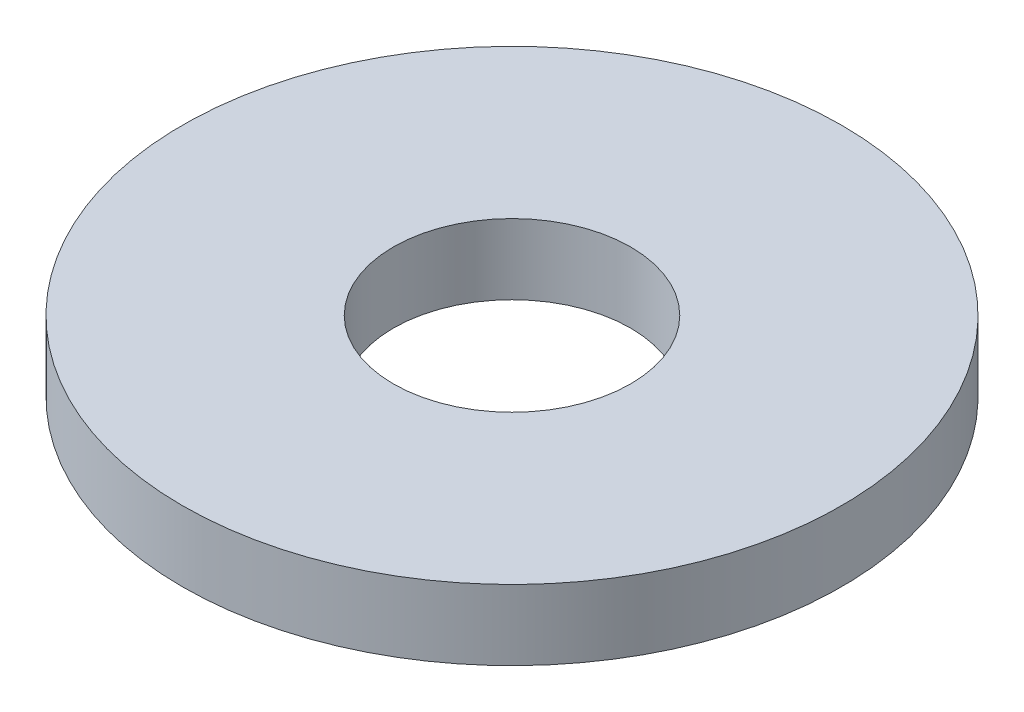
from build123d import *

# Parameters (mm, degrees)
SKETCH1_W = 2.4
SKETCH1_H = 0.8


with BuildPart() as part:
    # Sketch1 → Revolve1 (revolve)
    with BuildSketch(Plane.XY, mode=Mode.PRIVATE) as revolve1_sk:
        with Locations((-2.55, 0.4)):
            Rectangle(SKETCH1_W, SKETCH1_H)
    revolve(revolve1_sk.sketch.rotate(Axis((0, 0, 0), (0, 1, 0)), 270), axis=Axis((0, 0, 0), (0, 1, 0)))


solid = part.part
